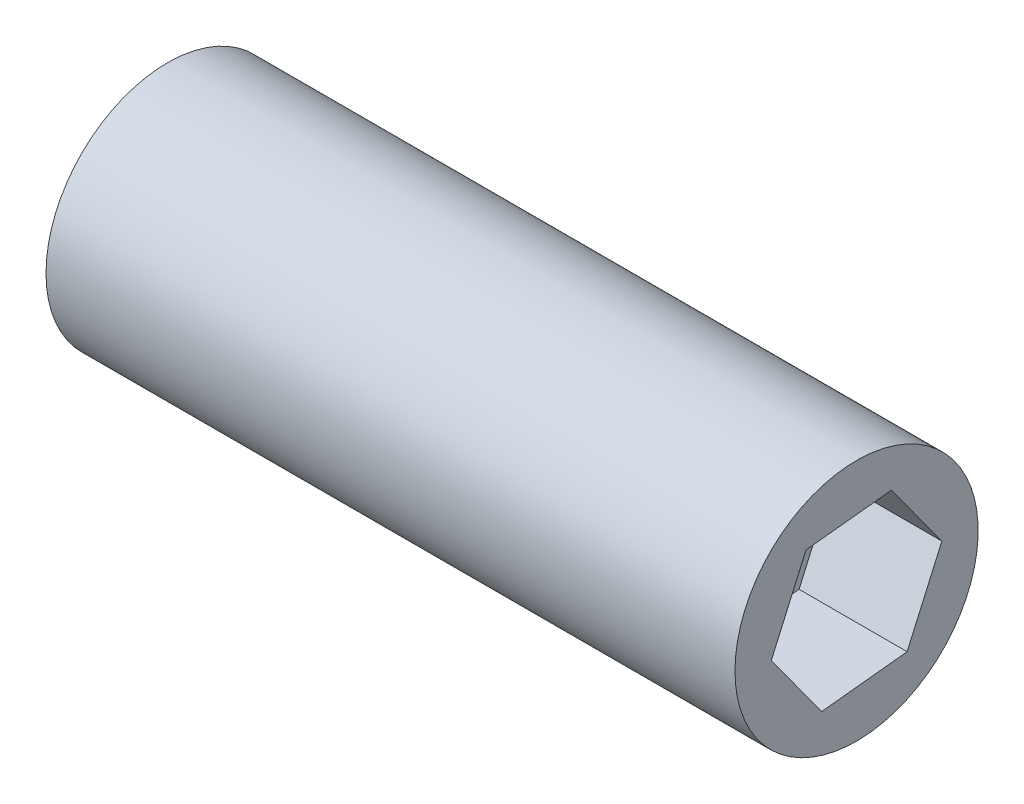
from build123d import *

# Parameters (mm, degrees)
BOSS_EXTRUDE1_DEPTH            = 12.75
BOSS_EXTRUDE1_DEPTH_BACK       = 12.75
SKETCH1_R                      = 4.5
CUT_EXTRUDE1_DEPTH             = 4
CUT_EXTRUDE3_REACH             = 16.25
SKETCH4_R                      = 1.6
CUT_EXTRUDE3_DIRECTION_2_REACH = 16.25


with BuildPart() as part:
    # Sketch1 → Boss-Extrude1 (new, two sides: drawn at the far end of the back side and taken through both)
    with BuildSketch(Plane(origin=(0, 0, 0), x_dir=(0, 0, -1), z_dir=(1, 0, 0)).offset(-BOSS_EXTRUDE1_DEPTH_BACK)):
        with Locations(Location((0, 0, 0), (0, 0, 180))):
            Circle(SKETCH1_R)
    extrude(amount=BOSS_EXTRUDE1_DEPTH + BOSS_EXTRUDE1_DEPTH_BACK)

    # Sketch2 → Cut-Extrude1 (cut)
    with BuildSketch(Plane.ZY.offset(12.75)):
        Polygon((3.157465818, -0.337257977), (1.870806885, 2.565816621), (-1.286658933, 2.903074598), (-3.157465818, 0.337257977), (-1.870806885, -2.565816621), (1.286658933, -2.903074598), align=None)
    cut_extrude1 = extrude(amount=-CUT_EXTRUDE1_DEPTH, mode=Mode.SUBTRACT)

    # Mirror1: Cut-Extrude1 across plane
    add(cut_extrude1.mirror(Plane(origin=(0, 0, 0), x_dir=(0, 0, 1), z_dir=(1, 0, 0))), mode=Mode.SUBTRACT)

    # Cut-Extrude3: up to this face of the body (flat: up to its plane)
    cut_extrude3_end = Plane(part.part.faces().sort_by_distance((-8.75, 0, 0))[0])
    # Sketch4 → Cut-Extrude3 (cut, up to the picked face)
    with BuildSketch(Plane(origin=(0, 0, 0), x_dir=(0, 0, -1), z_dir=(1, 0, 0)), mode=Mode.PRIVATE) as cut_extrude3_sk1:
        Circle(SKETCH4_R)
    cut_extrude3_tool1 = split(extrude(cut_extrude3_sk1.sketch, amount=-CUT_EXTRUDE3_REACH, mode=Mode.PRIVATE), bisect_by=cut_extrude3_end, keep=Keep.BOTH, mode=Mode.PRIVATE)
    add(cut_extrude3_tool1.solids().sort_by(Axis((0, 0, 0), (-1, 0, 0)))[0], mode=Mode.SUBTRACT)

    # Cut-Extrude3 direction 2: up to this face of the body (flat: up to its plane)
    cut_extrude3_direction_2_end = Plane(part.part.faces().sort_by_distance((8.75, 0, 0))[0])
    # Sketch4 → Cut-Extrude3 direction 2 (cut, up to the picked face)
    with BuildSketch(Plane(origin=(0, 0, 0), x_dir=(0, 0, -1), z_dir=(1, 0, 0)), mode=Mode.PRIVATE) as cut_extrude3_direction_2_sk1:
        Circle(SKETCH4_R)
    cut_extrude3_direction_2_tool1 = split(extrude(cut_extrude3_direction_2_sk1.sketch, amount=CUT_EXTRUDE3_DIRECTION_2_REACH, mode=Mode.PRIVATE), bisect_by=cut_extrude3_direction_2_end, keep=Keep.BOTH, mode=Mode.PRIVATE)
    add(cut_extrude3_direction_2_tool1.solids().sort_by(Axis((0, 0, 0), (1, 0, 0)))[0], mode=Mode.SUBTRACT)


solid = part.part
